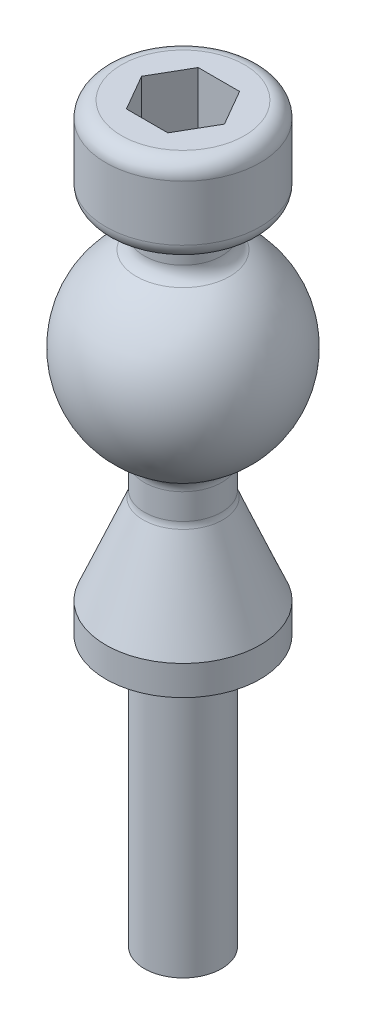
from build123d import *

# Parameters (mm, degrees)
CUT_EXTRUDE2_DEPTH = 2.54


with BuildPart() as part:
    # Sketch1 → Revolve1 (revolve)
    with BuildSketch(Plane.XY, mode=Mode.PRIVATE) as revolve1_sk:
        with BuildLine():
            Line((0, 15.24), (0, -8.89))
            Line((0, -8.89), (1.27, -8.89))
            Line((1.27, -8.89), (1.27, 0))
            Line((1.27, 0), (2.54, 0))
            Line((2.54, 0), (2.54, 0.974628867))
            Line((2.54, 0.974628867), (1.309653639, 3.927460134))
            ThreePointArc((1.309653639, 3.927460134), (1.280010609, 4.024630989), (1.27, 4.125728328))
            Line((1.27, 4.125728328), (1.27, 4.972739402))
            ThreePointArc((1.27, 4.972739402), (1.341479423, 5.234627913), (1.536094861, 5.423888926))
            ThreePointArc((1.536094861, 5.423888926), (3.175, 8.202564434), (1.536094861, 10.981239942))
            ThreePointArc((1.536094861, 10.981239942), (1.341479423, 11.170500955), (1.27, 11.432389465))
            Line((1.27, 11.432389465), (1.27, 11.867002695))
            ThreePointArc((1.27, 11.867002695), (1.420985665, 12.231514335), (1.785497305, 12.3825))
            Line((1.785497305, 12.3825), (2.024502695, 12.3825))
            ThreePointArc((2.024502695, 12.3825), (2.389014335, 12.533485665), (2.54, 12.897997305))
            Line((2.54, 12.897997305), (2.54, 14.724502695))
            ThreePointArc((2.54, 14.724502695), (2.389014335, 15.089014335), (2.024502695, 15.24))
            Line((2.024502695, 15.24), (0, 15.24))
        make_face()
    revolve(revolve1_sk.sketch.rotate(Axis((0, 15.24, 0), (0, -1, 0)), 180), axis=Axis((0, 15.24, 0), (0, -1, 0)))

    # Sketch2 → Cut-Extrude2 (cut)
    with BuildSketch(Plane(origin=(0, 15.24, 0), x_dir=(1, 0, 0), z_dir=(0, 1, 0))):
        Polygon((-1.363816806, 0), (-0.681908403, -1.1811), (0.681908403, -1.1811), (1.363816806, 0), (0.681908403, 1.1811), (-0.681908403, 1.1811), align=None)
    extrude(amount=-CUT_EXTRUDE2_DEPTH, mode=Mode.SUBTRACT)


solid = part.part
